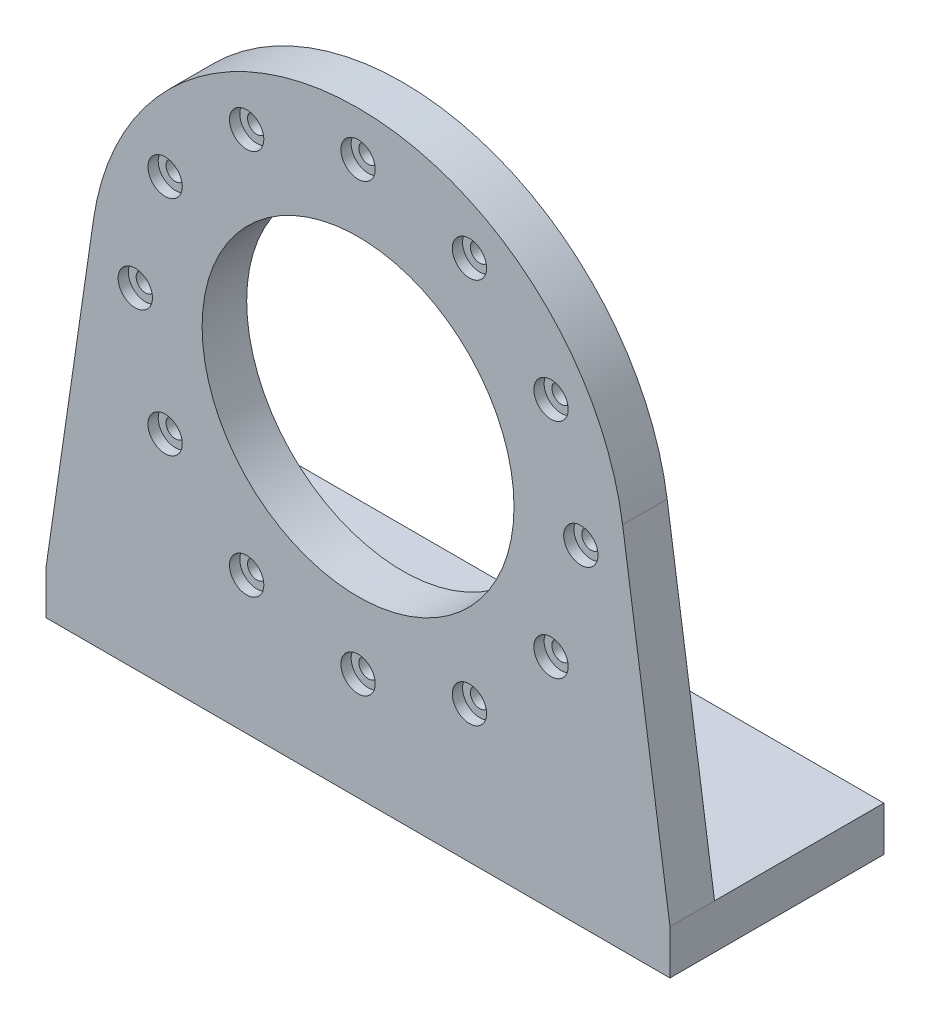
from build123d import *

# Parameters (mm, degrees)
SKETCH1_R           = 35
SKETCH1_R_2         = 2.1
BOSS_EXTRUDE1_DEPTH = 10
SKETCH2_W           = 140
SKETCH2_H           = 10
BOSS_EXTRUDE2_DEPTH = 48
SKETCH3_R           = 3.85
CUT_EXTRUDE1_DEPTH  = 2.3


with BuildPart() as part:
    # Sketch1 → Boss-Extrude1 (new body)
    with BuildSketch(Plane.XY):
        with BuildLine():
            Line((0, -64.1), (-70, -64.1))
            Line((-70, -64.1), (-59.369947745, 8.672329831))
            ThreePointArc((-59.369947745, 8.672329831), (0, 60), (59.369947745, 8.672329831))
            Line((59.369947745, 8.672329831), (70, -64.1))
            Line((70, -64.1), (0, -64.1))
        make_face()
        Circle(SKETCH1_R, mode=Mode.SUBTRACT)
        with Locations((-50, 0)):
            Circle(SKETCH1_R_2, mode=Mode.SUBTRACT)
        with Locations((-43.301270189, 25)):
            Circle(SKETCH1_R_2, mode=Mode.SUBTRACT)
        with Locations((-25, 43.301270189)):
            Circle(SKETCH1_R_2, mode=Mode.SUBTRACT)
        with Locations((0, 50)):
            Circle(SKETCH1_R_2, mode=Mode.SUBTRACT)
        with Locations((25, 43.301270189)):
            Circle(SKETCH1_R_2, mode=Mode.SUBTRACT)
        with Locations((43.301270189, 25)):
            Circle(SKETCH1_R_2, mode=Mode.SUBTRACT)
        with Locations((50, 0)):
            Circle(SKETCH1_R_2, mode=Mode.SUBTRACT)
        with Locations((43.301270189, -25)):
            Circle(SKETCH1_R_2, mode=Mode.SUBTRACT)
        with Locations((25, -43.301270189)):
            Circle(SKETCH1_R_2, mode=Mode.SUBTRACT)
        with Locations((0, -50)):
            Circle(SKETCH1_R_2, mode=Mode.SUBTRACT)
        with Locations((-25, -43.301270189)):
            Circle(SKETCH1_R_2, mode=Mode.SUBTRACT)
        with Locations((-43.301270189, -25)):
            Circle(SKETCH1_R_2, mode=Mode.SUBTRACT)
    extrude(amount=BOSS_EXTRUDE1_DEPTH)

    # Sketch2 → Boss-Extrude2 (add)
    with BuildSketch(Plane.XY.offset(10)):
        with Locations((0, -69.1)):
            Rectangle(SKETCH2_W, SKETCH2_H)
    extrude(amount=-BOSS_EXTRUDE2_DEPTH)

    # Sketch3 → Cut-Extrude1 (cut)
    with BuildSketch(Plane.XY.offset(10)):
        with Locations((0, -50)):
            Circle(SKETCH3_R)
        with Locations((-25, -43.301270189)):
            Circle(SKETCH3_R)
        with Locations((-43.301270189, -25)):
            Circle(SKETCH3_R)
        with Locations((-50, 0)):
            Circle(SKETCH3_R)
        with Locations((-43.301270189, 25)):
            Circle(SKETCH3_R)
        with Locations((-25, 43.301270189)):
            Circle(SKETCH3_R)
        with Locations((0, 50)):
            Circle(SKETCH3_R)
        with Locations((25, 43.301270189)):
            Circle(SKETCH3_R)
        with Locations((43.301270189, 25)):
            Circle(SKETCH3_R)
        with Locations((50, 0)):
            Circle(SKETCH3_R)
        with Locations((43.301270189, -25)):
            Circle(SKETCH3_R)
        with Locations((25, -43.301270189)):
            Circle(SKETCH3_R)
    extrude(amount=-CUT_EXTRUDE1_DEPTH, mode=Mode.SUBTRACT)


solid = part.part
